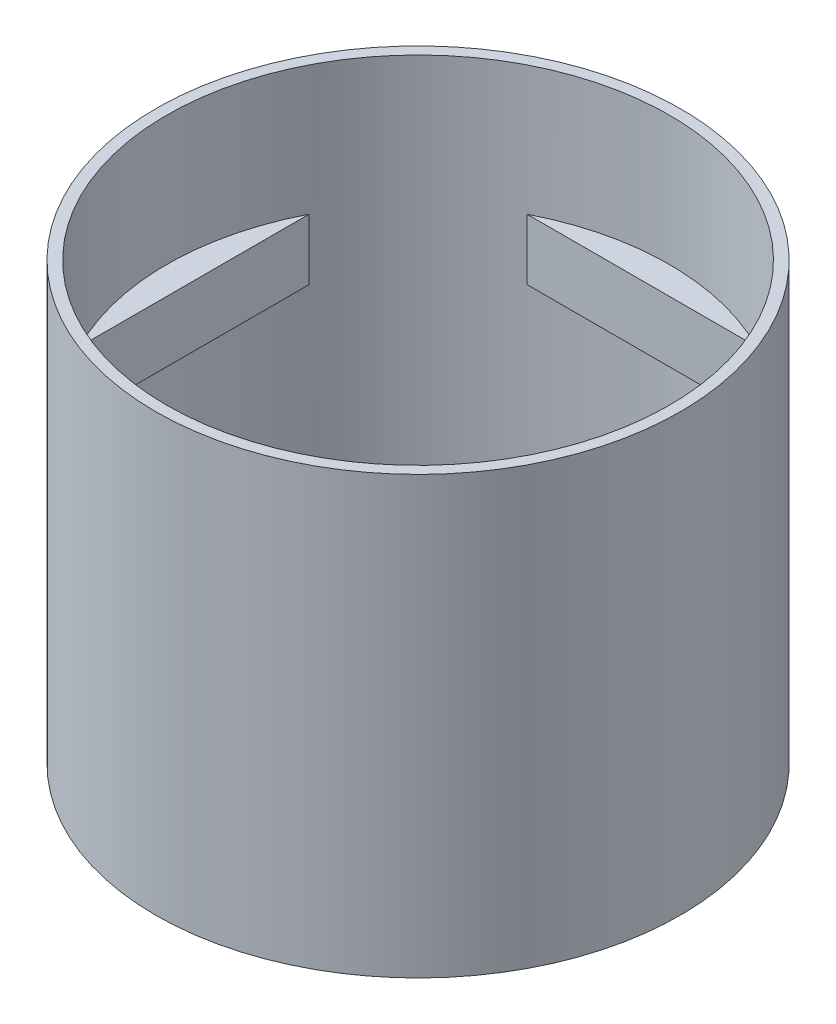
from build123d import *

# Parameters (mm, degrees)
SKETCH_1_R      = 71
SKETCH_1_R_2    = 68
EXTRUDE_1_DEPTH = 118
EXTRUDE_START   = 66.5
EXTRUDE_9_DEPTH = 16.5


with BuildPart() as part:
    # 草圖1 → 填料-伸長1 (new body)
    with BuildSketch(Plane(origin=(0, 0, 0), x_dir=(1, 0, 0), z_dir=(0, 1, 0))):
        with Locations(Location((0, 0, 0), (0, 0, 270))):
            Circle(SKETCH_1_R)
        with Locations(Location((0, 0, 0), (0, 0, 270))):
            Circle(SKETCH_1_R_2, mode=Mode.SUBTRACT)
    extrude(amount=EXTRUDE_1_DEPTH)

    # 草圖5 → 填料-伸長9 (add)
    with BuildSketch(Plane(origin=(0, 0, 0), x_dir=(1, 0, 0), z_dir=(0, 1, 0)).offset(EXTRUDE_START)):
        with BuildLine():
            Line((-11, -60.519057708), (-31.007154887, -60.519057708))
            ThreePointArc((-31.007154887, -60.519057708), (0, -68), (31.007154887, -60.519057708))
            Line((31.007154887, -60.519057708), (11, -60.519057708))
            Line((11, -60.519057708), (8.25, -60.519057708))
            Line((8.25, -60.519057708), (-8.25, -60.519057708))
            Line((-8.25, -60.519057708), (-11, -60.519057708))
        make_face()
        with BuildLine():
            ThreePointArc((31.007154887, 60.519057708), (0, 68), (-31.007154887, 60.519057708))
            Line((-31.007154887, 60.519057708), (-11, 60.519057708))
            Line((-11, 60.519057708), (-8.25, 60.519057708))
            Line((-8.25, 60.519057708), (8.25, 60.519057708))
            Line((8.25, 60.519057708), (11, 60.519057708))
            Line((11, 60.519057708), (31.007154887, 60.519057708))
        make_face()
        with BuildLine():
            Line((-60.519057708, -31.007154887), (-60.519057708, -11))
            Line((-60.519057708, -11), (-60.519057708, -8.25))
            Line((-60.519057708, -8.25), (-60.519057708, 8.25))
            Line((-60.519057708, 8.25), (-60.519057708, 11))
            Line((-60.519057708, 11), (-60.519057708, 31.007154887))
            ThreePointArc((-60.519057708, 31.007154887), (-68, 0), (-60.519057708, -31.007154887))
        make_face()
        with BuildLine():
            Line((60.519057708, -11), (60.519057708, -31.007154887))
            ThreePointArc((60.519057708, -31.007154887), (66.103312792, -15.948418039), (68, 0))
            ThreePointArc((68, 0), (66.103312792, 15.948418039), (60.519057708, 31.007154887))
            Line((60.519057708, 31.007154887), (60.519057708, 11))
            Line((60.519057708, 11), (60.519057708, 8.25))
            Line((60.519057708, 8.25), (60.519057708, -8.25))
            Line((60.519057708, -8.25), (60.519057708, -11))
        make_face()
    extrude(amount=EXTRUDE_9_DEPTH)


solid = part.part
